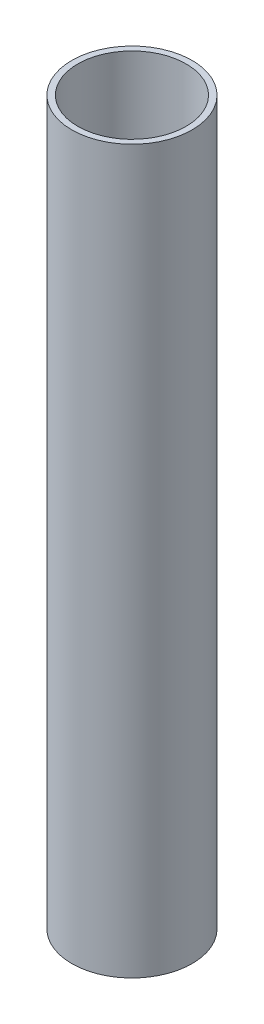
from build123d import *

# Parameters (mm, degrees)
SKETCH1_R           = 1
SKETCH1_R_2         = 0.9
BOSS_EXTRUDE1_DEPTH = 12


with BuildPart() as part:
    # Sketch1 → Boss-Extrude1 (new body)
    with BuildSketch(Plane(origin=(0, 0, 0), x_dir=(1, 0, 0), z_dir=(0, 1, 0))):
        with Locations(Location((0, 0, 0), (0, 0, 270))):
            Circle(SKETCH1_R)
        with Locations(Location((0, 0, 0), (0, 0, 270))):
            Circle(SKETCH1_R_2, mode=Mode.SUBTRACT)
    extrude(amount=BOSS_EXTRUDE1_DEPTH)


solid = part.part
